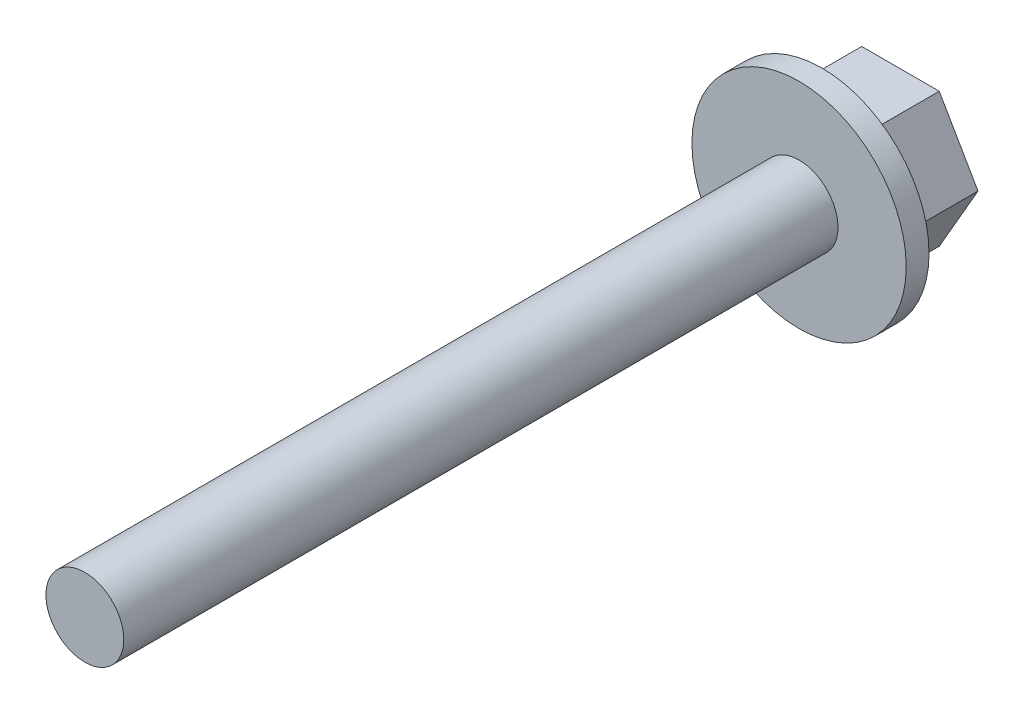
from build123d import *

# Parameters (mm, degrees)
BOSS_EXTRUDE1_DEPTH = 2.794
SKETCH2_R           = 3.81
BOSS_EXTRUDE2_DEPTH = 0.8128
SKETCH3_R           = 1.3843
BOSS_EXTRUDE3_DEPTH = 25.4


with BuildPart() as part:
    # Sketch1 → Boss-Extrude1 (new body)
    with BuildSketch(Plane.XY):
        Polygon((2.756963005, 0), (1.378481503, 2.3876), (-1.378481503, 2.3876), (-2.756963005, 0), (-1.378481503, -2.3876), (1.378481503, -2.3876), align=None)
    extrude(amount=BOSS_EXTRUDE1_DEPTH)

    # Sketch2 → Boss-Extrude2 (add)
    with BuildSketch(Plane.XY.offset(2.794)):
        Circle(SKETCH2_R)
    extrude(amount=BOSS_EXTRUDE2_DEPTH)

    # Sketch3 → Boss-Extrude3 (add)
    with BuildSketch(Plane.XY.offset(3.6068)):
        Circle(SKETCH3_R)
    extrude(amount=BOSS_EXTRUDE3_DEPTH)


solid = part.part
